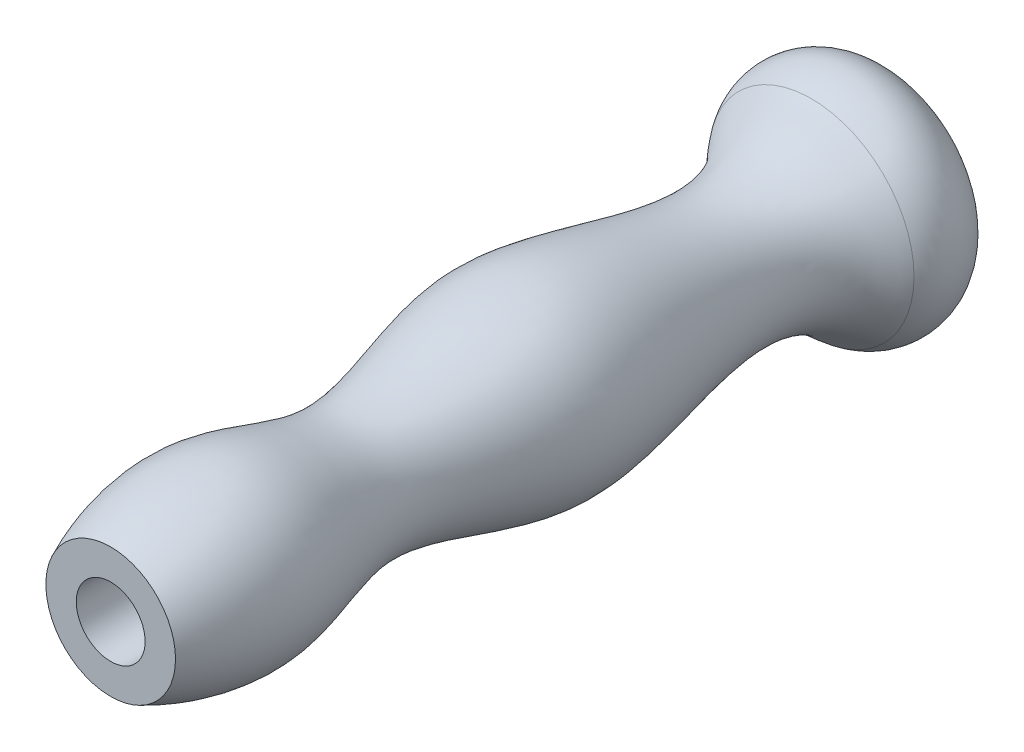
from build123d import *

# Parameters (mm, degrees)
CROQUIS2_R            = 4.25
CORTAR_EXTRUIR1_DEPTH = 121


with BuildPart() as part:
    # Croquis1 → Revolución1 (revolve)
    with BuildSketch(Plane(origin=(0, 0, 0), x_dir=(0, 0, -1), z_dir=(1, 0, 0)), mode=Mode.PRIVATE) as revoluci_n1_sk:
        with BuildLine():
            Line((-55.704716564, 0), (-55.704716564, 8))
            add(Edge.make_bspline(
                [(-55.704716564, 8), (-51.183710062, 10.068134077), (-44.683158551, 11.548030346), (-35.280080741, 9.789856302), (-23.735624334, 5.122063382), (-2.829195906, 17.767975146), (20.964100167, 2.745047777), (29.911411888, 12.064404114), (30.770120934, 12.68561812)],
                knots=[0, 0, 0, 0, 0.161960964, 0.202043766, 0.307705979, 0.544761784, 0.912350147, 0.94649864, 0.94649864, 0.94649864, 0.94649864], degree=3))
            ThreePointArc((30.770120934, 12.68561812), (37.678140046, 13.218649059), (41.295283436, 7.309239297))
            Line((41.295283436, 7.309239297), (41.295283436, 0))
            Line((41.295283436, 0), (-55.704716564, 0))
        make_face()
    revolve(revoluci_n1_sk.sketch.rotate(Axis((0, 0, 65.08119007), (0, 0, -1)), 90), axis=Axis((0, 0, 65.08119007), (0, 0, -1)))

    # Croquis2 → Cortar-Extruir1 (cut)
    with BuildSketch(Plane.XY.offset(55.704716564)):
        Circle(CROQUIS2_R)
    extrude(amount=-CORTAR_EXTRUIR1_DEPTH, mode=Mode.SUBTRACT)


solid = part.part
